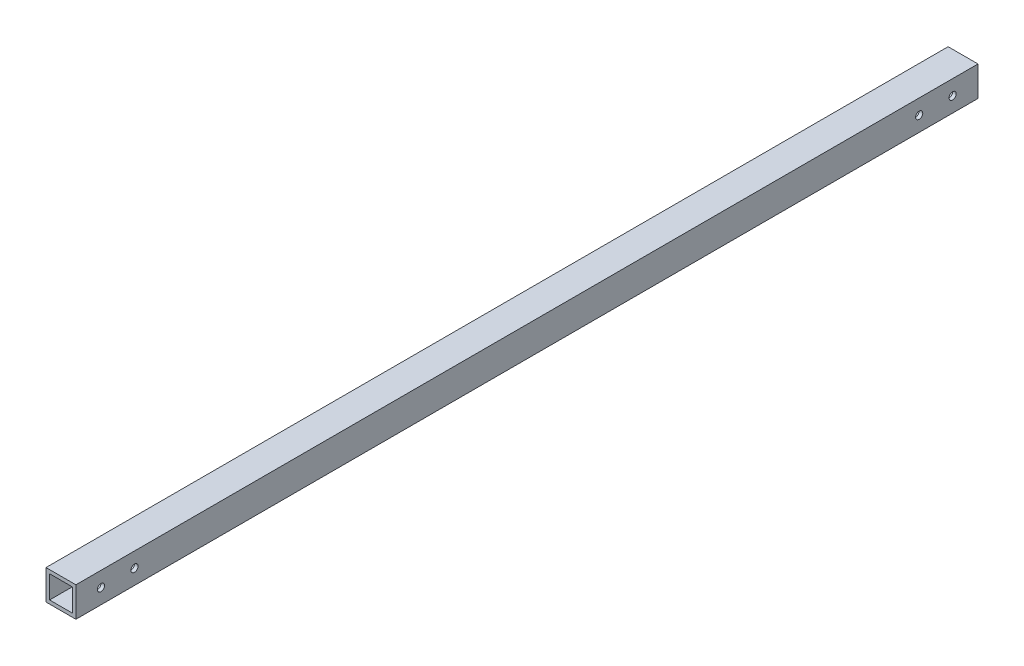
from build123d import *

# Parameters (mm, degrees)
SKETCH_1_W             = 25
SKETCH_1_H             = 25
SKETCH_1_W_2           = 19
SKETCH_1_H_2           = 19
EXTRUDE_1_DEPTH        = 754.5
HOLE_WIZARD_6_0_6_1_D  = 6
CUT_EXTRUDE_1_REACH    = 757.328
SKETCH_5_R             = 6
PATTERN_LINEAR_1_COUNT = 2
PATTERN_LINEAR_1_PITCH = 684.3


with BuildPart() as part:
    # 草图1 → 拉伸1 (new body)
    with BuildSketch(Plane.XY):
        with Locations((12.5, -12.5)):
            Rectangle(SKETCH_1_W, SKETCH_1_H)
        with Locations((12.5, -12.5)):
            Rectangle(SKETCH_1_W_2, SKETCH_1_H_2, mode=Mode.SUBTRACT)
    extrude(amount=EXTRUDE_1_DEPTH)

    # Ø6.0 (6) 直径孔1 (through all)
    with Locations(Plane(origin=(25, 0, 0), x_dir=(0, 0, -1), z_dir=(1, 0, 0))):
        with Locations((-705.5, -12.5), (-733.5, -12.5)):
            hole_wizard_6_0_6_1 = Hole(HOLE_WIZARD_6_0_6_1_D / 2)

    # 草图5 → 切除-拉伸1 (cut, up to next)
    with BuildSketch(Plane.ZY, mode=Mode.PRIVATE) as cut_extrude_1_sk1:
        with Locations(Location((705.5, -12.5, 0), (0, 0, 270))):
            Circle(SKETCH_5_R)
    cut_extrude_1_tool1 = extrude(cut_extrude_1_sk1.sketch, amount=-CUT_EXTRUDE_1_REACH, mode=Mode.PRIVATE) & part.part
    # 草图5 → 切除-拉伸1 (cut, up to next)
    with BuildSketch(Plane.ZY, mode=Mode.PRIVATE) as cut_extrude_1_sk2:
        with Locations(Location((733.5, -12.5, 0), (0, 0, 270))):
            Circle(SKETCH_5_R)
    cut_extrude_1_tool2 = extrude(cut_extrude_1_sk2.sketch, amount=-CUT_EXTRUDE_1_REACH, mode=Mode.PRIVATE) & part.part
    cut_extrude_1_1 = cut_extrude_1_tool1.solids().sort_by_distance((0, -12.5, 705.5))[0]
    add(cut_extrude_1_1, mode=Mode.SUBTRACT)
    cut_extrude_1_2 = cut_extrude_1_tool2.solids().sort_by_distance((0, -12.5, 733.5))[0]
    add(cut_extrude_1_2, mode=Mode.SUBTRACT)
    cut_extrude_1 = cut_extrude_1_1 + cut_extrude_1_2  # 切除-拉伸1 as one shape, for the pattern or mirror that repeats it

    # 阵列(线性)1: Ø6.0 (6) 直径孔1, 切除-拉伸1 ×2
    with Locations(*[(0, 0, -i * PATTERN_LINEAR_1_PITCH) for i in range(1, PATTERN_LINEAR_1_COUNT)]):
        add(hole_wizard_6_0_6_1, mode=Mode.SUBTRACT)
        add(cut_extrude_1, mode=Mode.SUBTRACT)


solid = part.part
